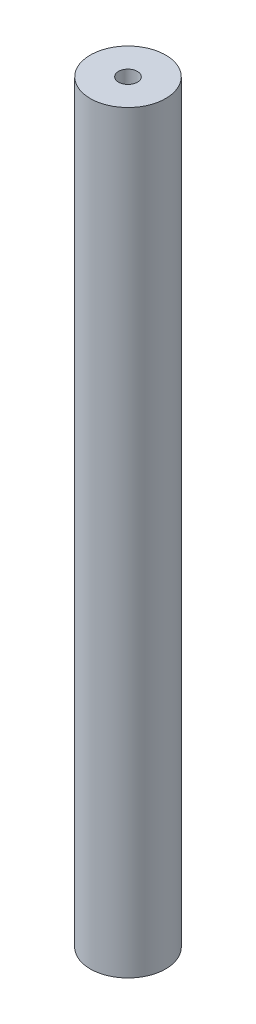
from build123d import *

# Parameters (mm, degrees)
SKETCH1_R           = 25.4
BOSS_EXTRUDE1_DEPTH = 508
SKETCH2_R           = 6.35
CUT_EXTRUDE1_DEPTH  = 508


with BuildPart() as part:
    # Sketch1 → Boss-Extrude1 (new body)
    with BuildSketch(Plane(origin=(0, 0, 0), x_dir=(1, 0, 0), z_dir=(0, 1, 0))):
        with Locations(Location((0, 0, 0), (0, 0, 270))):
            Circle(SKETCH1_R)
    extrude(amount=BOSS_EXTRUDE1_DEPTH)

    # Sketch2 → Cut-Extrude1 (cut)
    with BuildSketch(Plane(origin=(0, 508, 0), x_dir=(1, 0, 0), z_dir=(0, 1, 0))):
        with Locations(Location((0, 0, 0), (0, 0, 270))):
            Circle(SKETCH2_R)
    extrude(amount=-CUT_EXTRUDE1_DEPTH, mode=Mode.SUBTRACT)


solid = part.part
